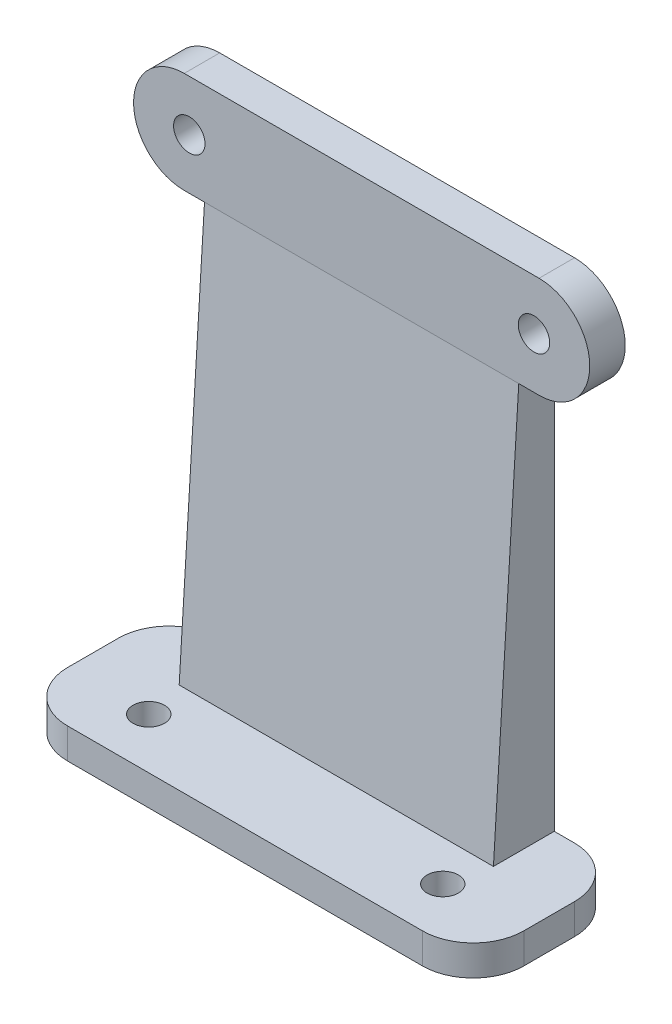
from build123d import *

# Parameters (mm, degrees)
EXTRUDE_1_DEPTH          = 2
EXTRUDE_1_DEPTH_BACK     = 1
SKETCH_1_W               = 45
SKETCH_1_H               = 15
SKETCH_2_W               = 45
SKETCH_2_H               = 3.5
EXTRUDE_2_DEPTH          = 50
SKETCH_3_R               = 1.55
CUT_EXTRUDE_1_DEPTH      = 69.92024376
SKETCH_4_R               = 1.55
CUT_EXTRUDE_2_DEPTH      = 71.384657419
SKETCH_5_W               = 31
SKETCH_5_H               = 5
EXTRUDE_4_DEPTH          = 10
SKETCH_8_W               = 7
SKETCH_8_H               = 40
CUT_EXTRUDE_5_DEPTH      = 10
FILLET_4_RADIUS          = 5
FILLET_4_LENGTH          = 3.5
FILLET_5_RADIUS          = 5
FILLET_5_LENGTH          = 3.5
CUT_EXTRUDE_7_DEPTH      = 67.128662469
CUT_EXTRUDE_7_DEPTH_BACK = 67.128662469
EXTRUDE_5_DEPTH          = 31
FILLET_6_R               = 5


with BuildPart() as part:
    # 草图1 → 凸台-拉伸1 (new, two sides: drawn at the far end of the back side and taken through both)
    with BuildSketch(Plane(origin=(0, 0, 0), x_dir=(1, 0, 0), z_dir=(0, 1, 0)).offset(-EXTRUDE_1_DEPTH_BACK)):
        with Locations((22.5, -7.5)):
            Rectangle(SKETCH_1_W, SKETCH_1_H)
    extrude(amount=EXTRUDE_1_DEPTH + EXTRUDE_1_DEPTH_BACK)

    # 草图2 → 凸台-拉伸2 (add)
    with BuildSketch(Plane(origin=(0, 2, 0), x_dir=(1, 0, 0), z_dir=(0, 1, 0))):
        with Locations((22.5, -1.75)):
            Rectangle(SKETCH_2_W, SKETCH_2_H)
    extrude(amount=EXTRUDE_2_DEPTH)

    # 草图3 → 切除-拉伸1 (cut, through all)
    with BuildSketch(Plane(origin=(0, 2, 0), x_dir=(1, 0, 0), z_dir=(0, 1, 0))):
        with Locations(Location((8, -10, 0), (0, 0, 270))):
            Circle(SKETCH_3_R)
        with Locations(Location((37, -10, 0), (0, 0, 270))):
            Circle(SKETCH_3_R)
    extrude(amount=-CUT_EXTRUDE_1_DEPTH, mode=Mode.SUBTRACT)

    # 草图4 → 切除-拉伸2 (cut, through all)
    with BuildSketch(Plane(origin=(0, 0, 0), x_dir=(-1, 0, 0), z_dir=(0, 0, -1))):
        with Locations((-39.5, 47)):
            Circle(SKETCH_4_R)
        with Locations((-5.5, 47)):
            Circle(SKETCH_4_R)
    extrude(amount=-CUT_EXTRUDE_2_DEPTH, mode=Mode.SUBTRACT)

    # 草图5 → 凸台-拉伸4 (add)
    with BuildSketch(Plane(origin=(0, 0, 0), x_dir=(-1, 0, 0), z_dir=(0, 0, -1))):
        with Locations((-22.5, 39.5)):
            Rectangle(SKETCH_5_W, SKETCH_5_H)
    extrude(amount=EXTRUDE_4_DEPTH)

    # 草图8 → 切除-拉伸5 (cut)
    with BuildSketch(Plane(origin=(0, 0, 0), x_dir=(-1, 0, 0), z_dir=(0, 0, -1))):
        with Locations((-41.5, 22)):
            Rectangle(SKETCH_8_W, SKETCH_8_H)
        with Locations((-3.5, 22)):
            Rectangle(SKETCH_8_W, SKETCH_8_H)
    extrude(amount=-CUT_EXTRUDE_5_DEPTH, mode=Mode.SUBTRACT)

    # 圆角4: full round fillet: the end face becomes a half cylinder, R = half its width
    fillet_4_face = Plane((45, 47, 1.75), x_dir=(0, 0, 1), z_dir=(1, 0, 0))  # on the end face: x along it, z out of the body
    fillet_4_slab = fillet_4_face.offset(-FILLET_4_RADIUS / 2) * Box(FILLET_4_LENGTH, 2 * FILLET_4_RADIUS, FILLET_4_RADIUS, mode=Mode.PRIVATE)  # the body's end, R deep
    fillet_4_round = Plane((40, 47, 1.75), x_dir=(1, 0, 0), z_dir=(0, 0, 1)) * Cylinder(FILLET_4_RADIUS, FILLET_4_LENGTH, mode=Mode.PRIVATE)  # its axis R under the face
    add(fillet_4_slab - fillet_4_round, mode=Mode.SUBTRACT)

    # 圆角5: full round fillet: the end face becomes a half cylinder, R = half its width
    fillet_5_face = Plane((0, 47, 1.75), x_dir=(0, 0, -1), z_dir=(-1, 0, 0))  # on the end face: x along it, z out of the body
    fillet_5_slab = fillet_5_face.offset(-FILLET_5_RADIUS / 2) * Box(FILLET_5_LENGTH, 2 * FILLET_5_RADIUS, FILLET_5_RADIUS, mode=Mode.PRIVATE)  # the body's end, R deep
    fillet_5_round = Plane((5, 47, 1.75), x_dir=(-1, 0, 0), z_dir=(0, 0, -1)) * Cylinder(FILLET_5_RADIUS, FILLET_5_LENGTH, mode=Mode.PRIVATE)  # its axis R under the face
    add(fillet_5_slab - fillet_5_round, mode=Mode.SUBTRACT)

    # 草图18 → 切除-拉伸7 (cut, two sides: drawn at the far end of the back side and taken through both)
    with BuildSketch(Plane.ZY.offset(-7).offset(-CUT_EXTRUDE_7_DEPTH_BACK)):
        Polygon((0, 37), (0, 42.006951797), (-10, 42), (-10, 37), align=None)
    extrude(amount=CUT_EXTRUDE_7_DEPTH + CUT_EXTRUDE_7_DEPTH_BACK, mode=Mode.SUBTRACT)

    # 草图20 → 凸台-拉伸5 (add)
    with BuildSketch(Plane.ZY.offset(-7)):
        Polygon((3.5, 42), (6, 2), (3.5, 2), align=None)
    extrude(amount=-EXTRUDE_5_DEPTH)

    # 圆角6
    fillet_6_edges = [part.edges().sort_by_distance(p)[0] for p in [
        (0, 0.5, 0),
        (45, 0.5, 0),
        (45, 0.5, 15),
        (0, 0.5, 15),
    ]]
    fillet(fillet_6_edges, radius=FILLET_6_R)


solid = part.part
